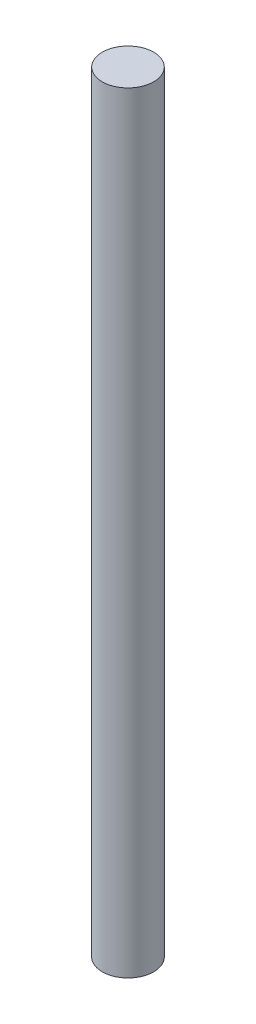
from build123d import *

# Parameters (mm, degrees)
SKETCH1_R           = 5
BOSS_EXTRUDE1_DEPTH = 150


with BuildPart() as part:
    # Sketch1 → Boss-Extrude1 (new body)
    with BuildSketch(Plane(origin=(0, 0, 0), x_dir=(1, 0, 0), z_dir=(0, 1, 0))):
        with Locations(Location((0, 0, 0), (0, 0, 270))):
            Circle(SKETCH1_R)
    extrude(amount=BOSS_EXTRUDE1_DEPTH)


solid = part.part
